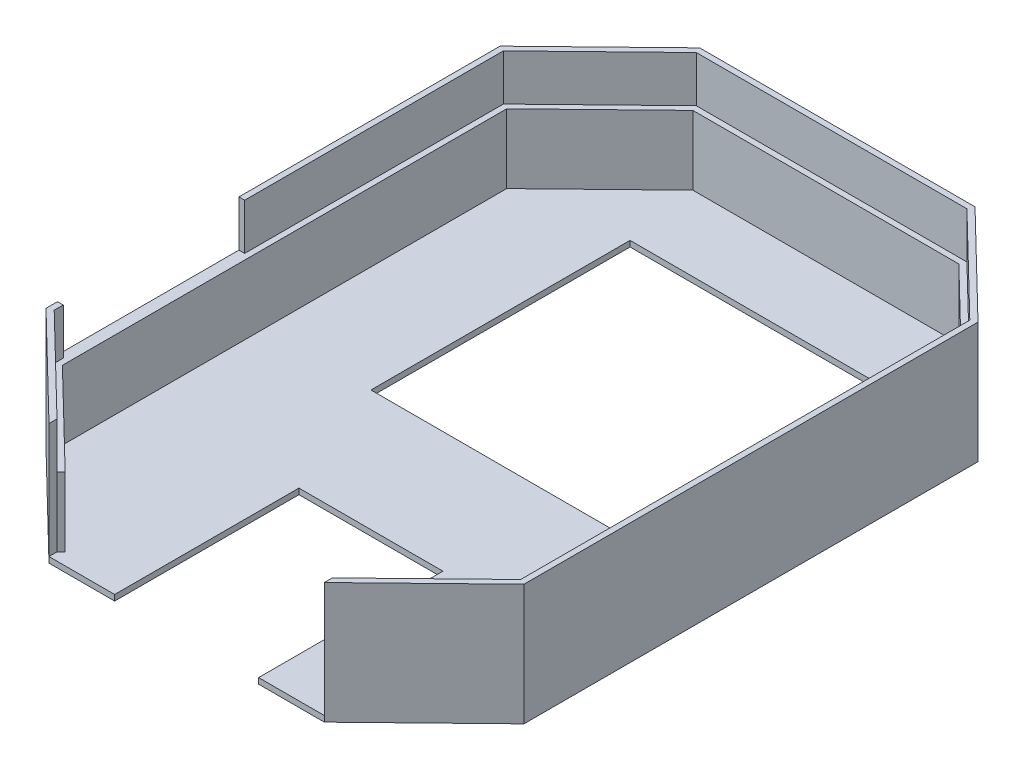
from build123d import *

# Parameters (mm, degrees)
SALIENTE_EXTRUIR1_DEPTH = 20
VACIADO1_T              = 1
CORTAR_EXTRUIR1_REACH   = 143.043
CROQUIS2_W              = 47.810995816
CROQUIS2_H              = 20
CORTAR_EXTRUIR7_REACH   = 142.243
CROQUIS10_W             = 25
CROQUIS10_H             = 32
CORTAR_EXTRUIR8_REACH   = 142.83
CROQUIS11_W             = 31.5
CROQUIS11_H             = 8
SALIENTE_EXTRUIR2_DEPTH = 12
CORTAR_EXTRUIR9_REACH   = 142.389
CROQUIS13_W             = 42
CROQUIS13_H             = 45


with BuildPart() as part:
    # Croquis1 → Saliente-Extruir1 (new body)
    with BuildSketch(Plane(origin=(0, 0, 0), x_dir=(1, 0, 0), z_dir=(0, 1, 0))):
        Polygon((0, 16.5), (17, 0), (64, 0), (81, 16.5), (81, 94.5), (64, 111), (17, 111), (0, 94.5), align=None)
    extrude(amount=SALIENTE_EXTRUIR1_DEPTH)

    # Vaciado1
    vaciado1_openings = [part.faces().sort_by_distance(p)[0] for p in [
        (40.5, 20, -55.5),
    ]]
    offset(amount=VACIADO1_T, openings=vaciado1_openings, kind=Kind.INTERSECTION)

    # Croquis2 → Cortar-Extruir1 (cut, up to next)
    with BuildSketch(Plane.XY.offset(1), mode=Mode.PRIVATE) as cortar_extruir1_sk1:
        with Locations((40.5, 10)):
            Rectangle(CROQUIS2_W, CROQUIS2_H)
    cortar_extruir1_tool1 = extrude(cortar_extruir1_sk1.sketch, amount=-CORTAR_EXTRUIR1_REACH, mode=Mode.PRIVATE) & part.part
    add(cortar_extruir1_tool1.solids().sort_by_distance((40.5, 10, 1))[0], mode=Mode.SUBTRACT)

    # Croquis10 → Cortar-Extruir7 (cut, up to next)
    with BuildSketch(Plane(origin=(0, 0, 0), x_dir=(1, 0, 0), z_dir=(0, 1, 0)), mode=Mode.PRIVATE) as cortar_extruir7_sk1:
        with Locations((40.5, 15)):
            Rectangle(CROQUIS10_W, CROQUIS10_H)
    cortar_extruir7_tool1 = extrude(cortar_extruir7_sk1.sketch, amount=-CORTAR_EXTRUIR7_REACH, mode=Mode.PRIVATE) & part.part
    add(cortar_extruir7_tool1.solids().sort_by_distance((40.5, 0, -15))[0], mode=Mode.SUBTRACT)

    # Croquis11 → Cortar-Extruir8 (cut, up to next)
    with BuildSketch(Plane.ZY.offset(1), mode=Mode.PRIVATE) as cortar_extruir8_sk1:
        with Locations((-33.827016736, 16)):
            Rectangle(CROQUIS11_W, CROQUIS11_H)
    cortar_extruir8_tool1 = extrude(cortar_extruir8_sk1.sketch, amount=-CORTAR_EXTRUIR8_REACH, mode=Mode.PRIVATE) & part.part
    add(cortar_extruir8_tool1.solids().sort_by_distance((-1, 16, -33.827017))[0], mode=Mode.SUBTRACT)

    # Croquis12 → Saliente-Extruir2 (add)
    with BuildSketch(Plane(origin=(0, 0, 0), x_dir=(1, 0, 0), z_dir=(0, 1, 0))):
        Polygon((16.594502092, 0.393571499), (17.290977469, 1.111152191), (1, 16.922983264), (1, 94.077016736), (17.405497908, 110), (63.594502092, 110), (80, 94.077016736), (80, 16.922983264), (63.709022531, 1.111152191), (64.405497908, 0.393571499), (81, 16.5), (81, 94.5), (64, 111), (17, 111), (0, 94.5), (0, 16.5), align=None)
    extrude(amount=SALIENTE_EXTRUIR2_DEPTH)

    # Croquis13 → Cortar-Extruir9 (cut, up to next)
    with BuildSketch(Plane.XZ.offset(1), mode=Mode.PRIVATE) as cortar_extruir9_sk1:
        with Locations((40.5, -74.5)):
            Rectangle(CROQUIS13_W, CROQUIS13_H)
    cortar_extruir9_tool1 = extrude(cortar_extruir9_sk1.sketch, amount=-CORTAR_EXTRUIR9_REACH, mode=Mode.PRIVATE) & part.part
    add(cortar_extruir9_tool1.solids().sort_by_distance((40.5, -1, -74.5))[0], mode=Mode.SUBTRACT)


solid = part.part
